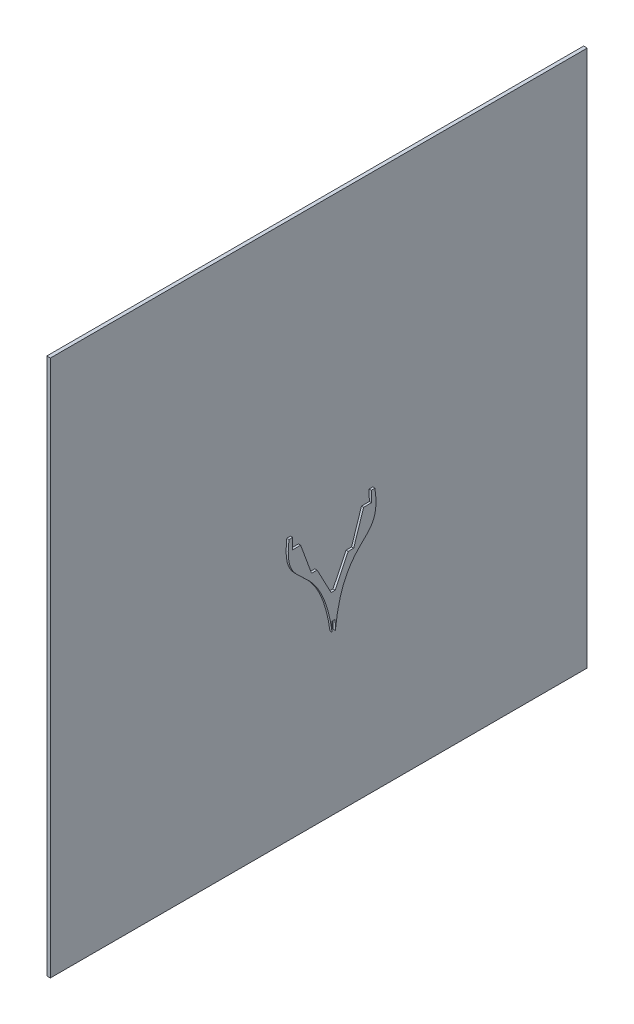
from build123d import *

# Parameters (mm, degrees)
BOSS_EXTRU_2_DEPTH      = 10
BOSS_EXTRU_3_DEPTH      = 6
ENL_V_MAT_EXTRU_1_DEPTH = 6


with BuildPart() as part:
    # Esquisse3D1 → Boss.-Extru.2 (new body)
    with BuildSketch(Plane(origin=(-20, 1121.289346724, 777.274991403), x_dir=(0, -0.7071067811865476, -0.7071067811865476), z_dir=(1, 0, 0))):
        Polygon((0, 0), (1060.66017178, 1060.66017178), (2121.32034356, 0), (1060.66017178, -1060.66017178), align=None)
    extrude(amount=BOSS_EXTRU_2_DEPTH)


with BuildPart() as body_2:
    # Esquisse5 → Boss.-Extru.3 (new body)
    with BuildSketch(Plane(origin=(0, 0, 0), x_dir=(0, 0, -1), z_dir=(1, 0, 0))):
        with BuildLine():
            Line((113.347440744, 369.201389217), (103.347440744, 369.020235444))
            Line((103.347440744, 369.020235444), (103.834856693, 338.725486257))
            Line((103.834856693, 338.725486257), (81.960922932, 338.329231694))
            Line((81.960922932, 338.329231694), (54.22539192, 253.60356451))
            Line((54.22539192, 253.60356451), (38.902622235, 253.325986757))
            Line((38.902622235, 253.325986757), (2.451611489, 177.902642332))
            Line((2.451611489, 177.902642332), (-8.893435381, 177.697122528))
            Line((-8.893435381, 177.697122528), (-48.052278153, 251.750765932))
            Line((-48.052278153, 251.750765932), (-63.375047838, 251.473188179))
            Line((-63.375047838, 251.473188179), (-94.161048869, 335.138715732))
            Line((-94.161048869, 335.138715732), (-116.034982631, 334.74246117))
            Line((-116.034982631, 334.74246117), (-116.645128026, 365.034987067))
            Line((-116.645128026, 365.034987067), (-126.645128026, 364.853833295))
            add(Edge.make_bspline(
                [(0, 0), (-0.762445712, 42.08831541), (-6.146856768, 339.317071991), (-148.130355402, 189.198989556), (-126.645128026, 364.853833295)],
                knots=[0, 0, 0, 0, 0, 1, 1, 1, 1, 1], degree=4))
            add(Edge.make_bspline(
                [(0, 0), (-0.762445712, 42.08831541), (-6.146856768, 339.317071991), (141.180590983, 194.439966494), (113.347440744, 369.201389217)],
                knots=[0, 0, 0, 0, 0, 1, 1, 1, 1, 1], degree=4))
        make_face()
    extrude(amount=BOSS_EXTRU_3_DEPTH)

    # Esquisse6 → Enlèv. mat.-Extru.1 (cut)
    with BuildSketch(Plane(origin=(6, 0, 0), x_dir=(0, 0, -1), z_dir=(1, 0, 0))):
        Polygon((-5.950473044, 79.987089035), (-6.43958823, 106.987089035), (2.56041177, 107.15012743), (3.049526956, 80.15012743), (117.063261114, -47.52702125), (-85.227699586, -65.220017949), align=None)
    extrude(amount=-ENL_V_MAT_EXTRU_1_DEPTH, mode=Mode.SUBTRACT)


solid = Compound([part.part, body_2.part])
